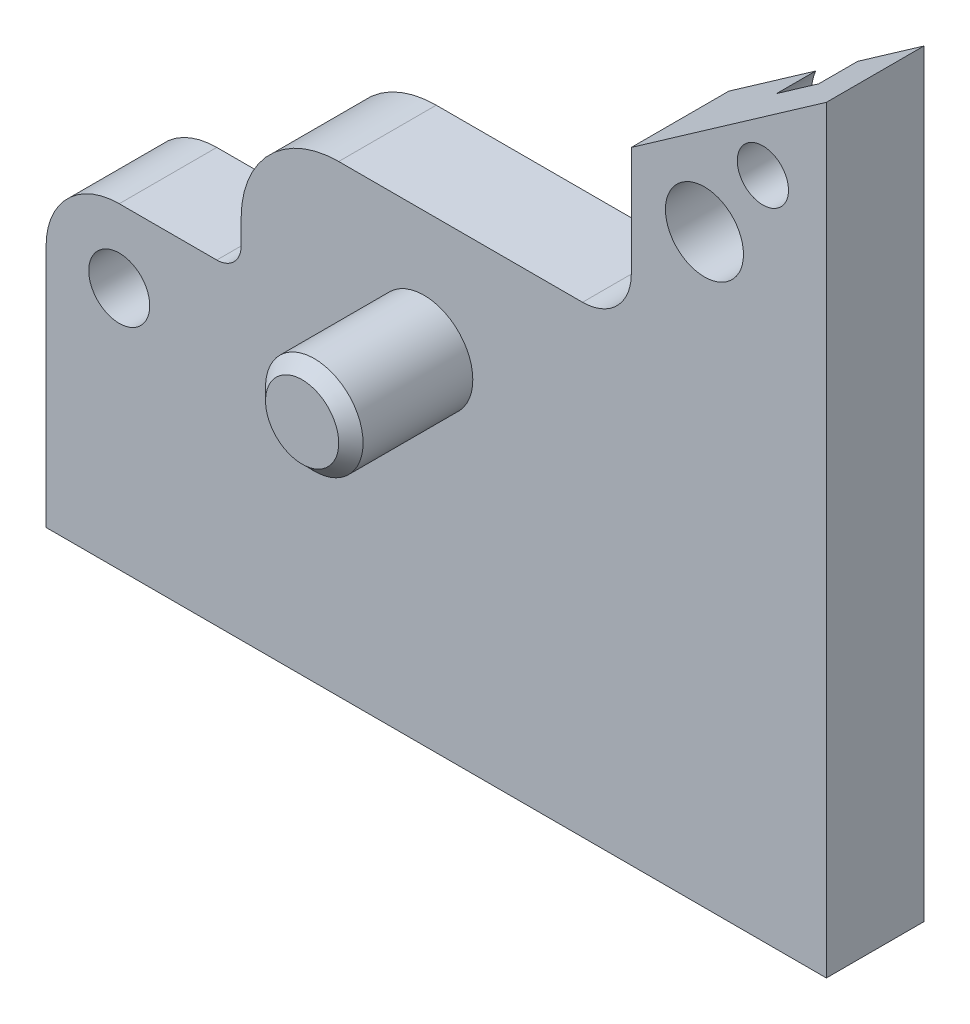
from build123d import *

# Parameters (mm, degrees)
SKETCH1_W                       = 32
SKETCH1_H                       = 25.5
BOSS_EXTRUDE1_DEPTH             = 4
SKETCH2_W                       = 8
SKETCH2_H                       = 12.5
CUT_EXTRUDE1_DEPTH              = 42.112650121
SKETCH3_W                       = 16
SKETCH3_H                       = 6.5
CUT_EXTRUDE2_DEPTH              = 42.112650121
DRAFT1_ANGLE                    = 35.000000002
SKETCH4_W                       = 2
SKETCH4_H                       = 5
SKETCH5_W                       = 2
SKETCH5_H                       = 5
F_2_5_2_5_DIAMETER_HOLE1_D      = 2.5
F_2_5_2_5_DIAMETER_HOLE1_DEPTH  = 9
F_3_2_3_2_DIAMETER_HOLE1_D      = 3.2
F_3_2_3_2_DIAMETER_HOLE1_DEPTH  = 9
M4X0_7_TAPPED_HOLE1_D           = 2.1
M4X0_7_TAPPED_HOLE1_DEPTH       = 9
M4X0_7_TAPPED_HOLE1_CBORE_D     = 4
M4X0_7_TAPPED_HOLE1_CBORE_DEPTH = 1.6
F_2_5_2_5_DIAMETER_HOLE2_D      = 2.5
F_2_5_2_5_DIAMETER_HOLE2_DEPTH  = 7.5
F_2_5_2_5_DIAMETER_HOLE2_TIP    = 0.751075774
CHAMFER1_SIZE                   = 0.5
FILLET1_R                       = 1
FILLET2_R                       = 2
FILLET3_R                       = 3
FILLET4_R                       = 4


with BuildPart() as part:
    # Sketch1 → Boss-Extrude1 (new body)
    with BuildSketch(Plane.XY.offset(4)):
        with Locations((16, 12.75)):
            Rectangle(SKETCH1_W, SKETCH1_H)
    extrude(amount=-BOSS_EXTRUDE1_DEPTH)

    # Sketch2 → Cut-Extrude1 (cut, through all)
    with BuildSketch(Plane(origin=(0, 0, 0), x_dir=(-1, 0, 0), z_dir=(0, 0, -1))):
        with Locations((-4, 19.25)):
            Rectangle(SKETCH2_W, SKETCH2_H)
    extrude(amount=-CUT_EXTRUDE1_DEPTH, mode=Mode.SUBTRACT)

    # Sketch3 → Cut-Extrude2 (cut, through all)
    with BuildSketch(Plane(origin=(0, 0, 0), x_dir=(-1, 0, 0), z_dir=(0, 0, -1))):
        with Locations((-16, 22.25)):
            Rectangle(SKETCH3_W, SKETCH3_H)
    extrude(amount=-CUT_EXTRUDE2_DEPTH, mode=Mode.SUBTRACT)

    # Draft1
    draft1_faces = [part.faces().sort_by_distance(p)[0] for p in [
        (28, 25.5, 2),
    ]]
    draft(draft1_faces, Plane(origin=(24, 25.5, 4), x_dir=(0, 0, -1), z_dir=(-1, 0, 0)), DRAFT1_ANGLE)

    # Sketch4 → Revolve1 (revolve)
    with BuildSketch(Plane(origin=(0, 5, 0), x_dir=(1, 0, 0), z_dir=(0, 1, 0))):
        with Locations((7, 2.5)):
            Rectangle(SKETCH4_W, SKETCH4_H)
    revolve(axis=Axis((6, 5, -5), (0, 0, 1)))

    # Sketch5 → Revolve2 (revolve)
    with BuildSketch(Plane.XZ.offset(-14), mode=Mode.PRIVATE) as revolve2_sk:
        with Locations((16.5, 6.5)):
            Rectangle(SKETCH5_W, SKETCH5_H)
    revolve(revolve2_sk.sketch.rotate(Axis((15.5, 14, 9), (0, 0, -1)), 180), axis=Axis((15.5, 14, 9), (0, 0, -1)))

    # Ø2.5 (2.5) Diameter Hole1
    with Locations(Plane.XY.offset(4)):
        with Locations((3, 10)):
            Hole(F_2_5_2_5_DIAMETER_HOLE1_D / 2, depth=F_2_5_2_5_DIAMETER_HOLE1_DEPTH)

    # Ø3.2 (3.2) Diameter Hole1
    with Locations(Plane(origin=(0, 0, 0), x_dir=(-1, 0, 0), z_dir=(0, 0, -1))):
        with Locations((-27, 24)):
            Hole(F_3_2_3_2_DIAMETER_HOLE1_D / 2, depth=F_3_2_3_2_DIAMETER_HOLE1_DEPTH)

    # M4x0.7 Tapped Hole1
    with Locations(Plane(origin=(0, 0, 0), x_dir=(-1, 0, 0), z_dir=(0, 0, -1))):
        with Locations((-29.395995182, 27.202999702)):
            CounterBoreHole(M4X0_7_TAPPED_HOLE1_D / 2, M4X0_7_TAPPED_HOLE1_CBORE_D / 2, M4X0_7_TAPPED_HOLE1_CBORE_DEPTH, depth=M4X0_7_TAPPED_HOLE1_DEPTH)

    # Ø2.5 (2.5) Diameter Hole2
    with Locations(Plane(origin=(0, 0, 0), x_dir=(-1, 0, 0), z_dir=(0, -1, 0))):
        with Locations((-10, -2), (-19.5, -2), (-29, -2)):
            Hole(F_2_5_2_5_DIAMETER_HOLE2_D / 2, depth=F_2_5_2_5_DIAMETER_HOLE2_DEPTH)
            with Locations((0, 0, -(F_2_5_2_5_DIAMETER_HOLE2_DEPTH + F_2_5_2_5_DIAMETER_HOLE2_TIP / 2))):  # 118° drill point
                Cone(0, F_2_5_2_5_DIAMETER_HOLE2_D / 2, F_2_5_2_5_DIAMETER_HOLE2_TIP, mode=Mode.SUBTRACT)

    # Chamfer1
    chamfer1_edges = [part.edges().sort_by_distance(p)[0] for p in [
        (4, 5, -5),
        (17.5, 14, 9),
    ]]
    chamfer(chamfer1_edges, length=CHAMFER1_SIZE)

    # Fillet1
    fillet1_edges = [part.edges().sort_by_distance(p)[0] for p in [
        (8, 13, 2),
    ]]
    fillet(fillet1_edges, radius=FILLET1_R)

    # Fillet2
    fillet2_edges = [part.edges().sort_by_distance(p)[0] for p in [
        (24, 19, 2),
    ]]
    fillet(fillet2_edges, radius=FILLET2_R)

    # Fillet3
    fillet3_edges = [part.edges().sort_by_distance(p)[0] for p in [
        (0, 13, 2),
    ]]
    fillet(fillet3_edges, radius=FILLET3_R)

    # Fillet4
    fillet4_edges = [part.edges().sort_by_distance(p)[0] for p in [
        (8, 19, 2),
    ]]
    fillet(fillet4_edges, radius=FILLET4_R)


solid = part.part
